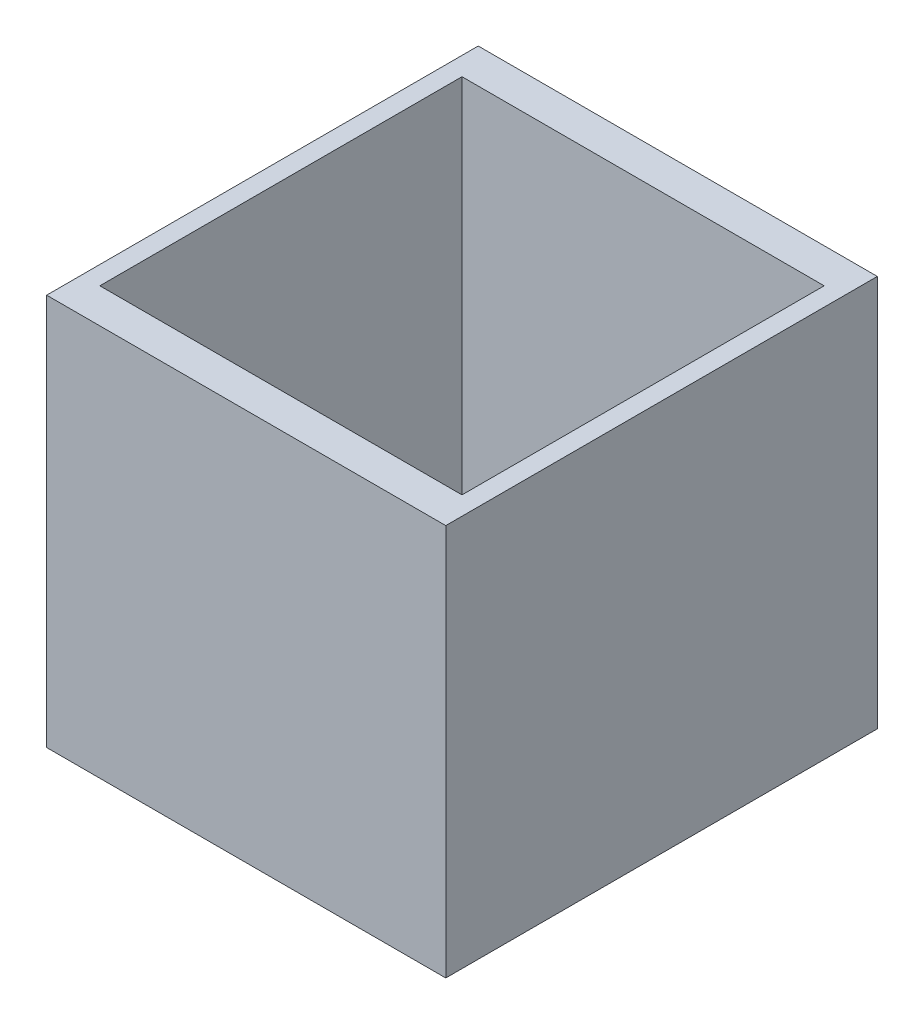
from build123d import *

# Parameters (mm, degrees)
SKETCH1_W           = 23.49
SKETCH1_H           = 25.4
SKETCH1_W_2         = 21.315
SKETCH1_H_2         = 21.315
BOSS_EXTRUDE1_DEPTH = 23.06


with BuildPart() as part:
    # Sketch1 → Boss-Extrude1 (new body)
    with BuildSketch(Plane(origin=(0, 0, 0), x_dir=(1, 0, 0), z_dir=(0, 1, 0))):
        Rectangle(SKETCH1_W, SKETCH1_H)
        Rectangle(SKETCH1_W_2, SKETCH1_H_2, mode=Mode.SUBTRACT)
    extrude(amount=BOSS_EXTRUDE1_DEPTH)


solid = part.part
